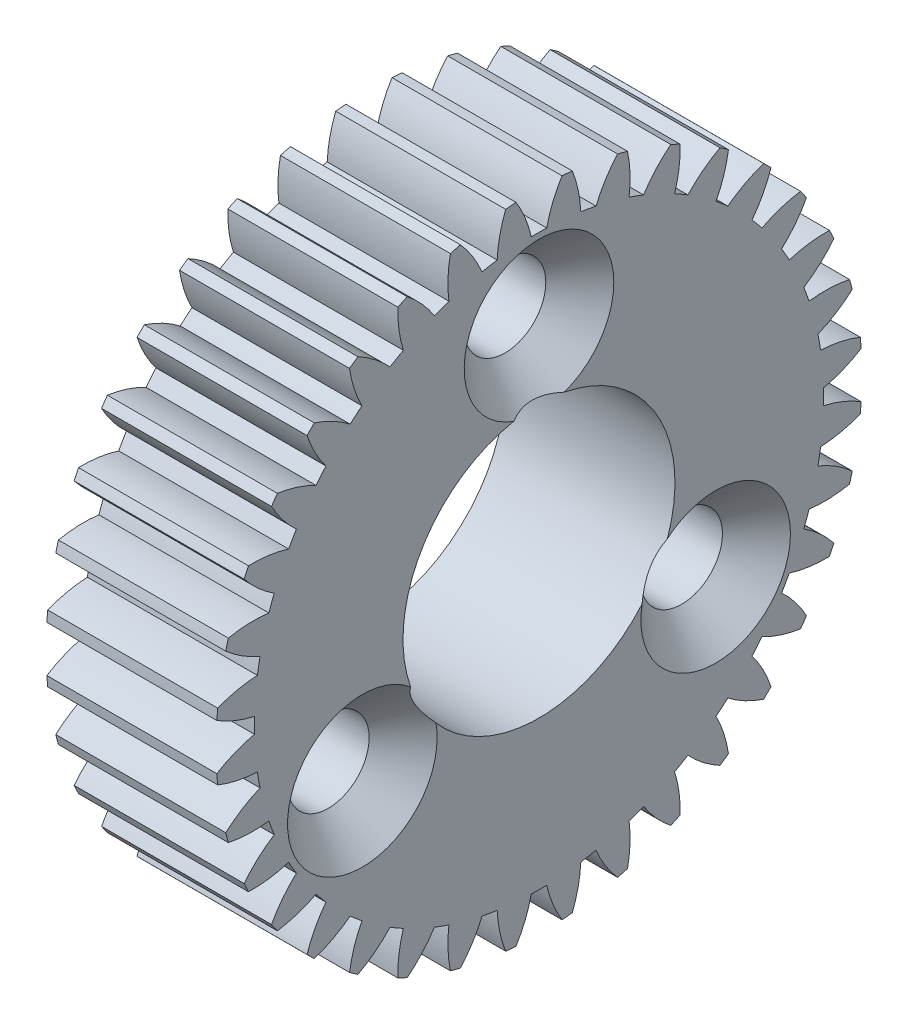
from build123d import *

# Parameters (mm, degrees)
BASPROSKE_W           = 5
BASPROSKE_H           = 9.5
TOOTHCUT_DEPTH        = 15.335271187
TEETHCUTS_COUNT       = 36
TEETHCUTS_ANGLE       = 350
BORSKE_R              = 4
BORE_DEPTH            = 50.0000508
PADR_OCIRCULAR1_COUNT = 3


with BuildPart() as part:
    # BasProSke → Base-Revolve (revolve)
    with BuildSketch(Plane(origin=(0, 0, 0), x_dir=(1, 0, 0), z_dir=(0, 1, 0)), mode=Mode.PRIVATE) as base_revolve_sk:
        with Locations((2.5, 4.75)):
            Rectangle(BASPROSKE_W, BASPROSKE_H)
    revolve(base_revolve_sk.sketch.rotate(Axis((-10, 0, 0), (1, 0, 0)), 180), axis=Axis((-10, 0, 0), (1, 0, 0)))

    # TooCutSke → ToothCut (cut, through all)
    with BuildSketch(Plane(origin=(0, 0, 0), x_dir=(0, 0, -1), z_dir=(1, 0, 0))):
        with BuildLine():
            ThreePointArc((0.227221176, 8.370916708), (0, 8.374), (-0.227221176, 8.370916708))
            ThreePointArc((-0.227221176, 8.370916708), (-0.411410437, 8.955426484), (-0.69207336, 9.500225241))
            ThreePointArc((-0.69207336, 9.500225241), (0, 9.5254), (0.69207336, 9.500225241))
            ThreePointArc((0.69207336, 9.500225241), (0.411410437, 8.955426484), (0.227221176, 8.370916708))
        make_face()
    toothcut = extrude(amount=TOOTHCUT_DEPTH, mode=Mode.SUBTRACT)

    # TeethCuts: ToothCut ×36 about axis
    teethcuts_axis = Axis((-10, 0, 0), (1, 0, 0))
    for i in range(1, TEETHCUTS_COUNT):
        add(toothcut.rotate(teethcuts_axis, i * TEETHCUTS_ANGLE / (TEETHCUTS_COUNT - 1)), mode=Mode.SUBTRACT)

    # BorSke → Bore (cut, symmetric)
    with BuildSketch(Plane(origin=(0, 0, 0), x_dir=(0, 0, -1), z_dir=(1, 0, 0))):
        with Locations(Location((0, 0, 0), (0, 0, 180))):
            Circle(BORSKE_R)
    extrude(amount=BORE_DEPTH, both=True, mode=Mode.SUBTRACT)

    # Esboço4 → Escareado para parafuso com cabeça escareada elevada de M21 (revolve, cut)
    with BuildSketch(Plane(origin=(5, 6, 0), x_dir=(0, 0, -1), z_dir=(0, 1, 0))):
        Polygon((0, 0), (0, 6.721032743), (1.2, 6), (1.2, 1), (2.2, 0), align=None)
    escareado_para_parafuso_com_cabe_a_escar = revolve(axis=Axis((11.35, 6, 0), (-1, 0, 0)), mode=Mode.SUBTRACT)

    # PadrãoCircular1: Escareado para parafuso com cabeça escareada elevada de M21 ×3 about axis
    padr_ocircular1_axis = Axis((0, 0, 0), (1, 0, 0))
    for i in range(1, PADR_OCIRCULAR1_COUNT):
        add(escareado_para_parafuso_com_cabe_a_escar.rotate(padr_ocircular1_axis, i * 360 / PADR_OCIRCULAR1_COUNT), mode=Mode.SUBTRACT)


solid = part.part
